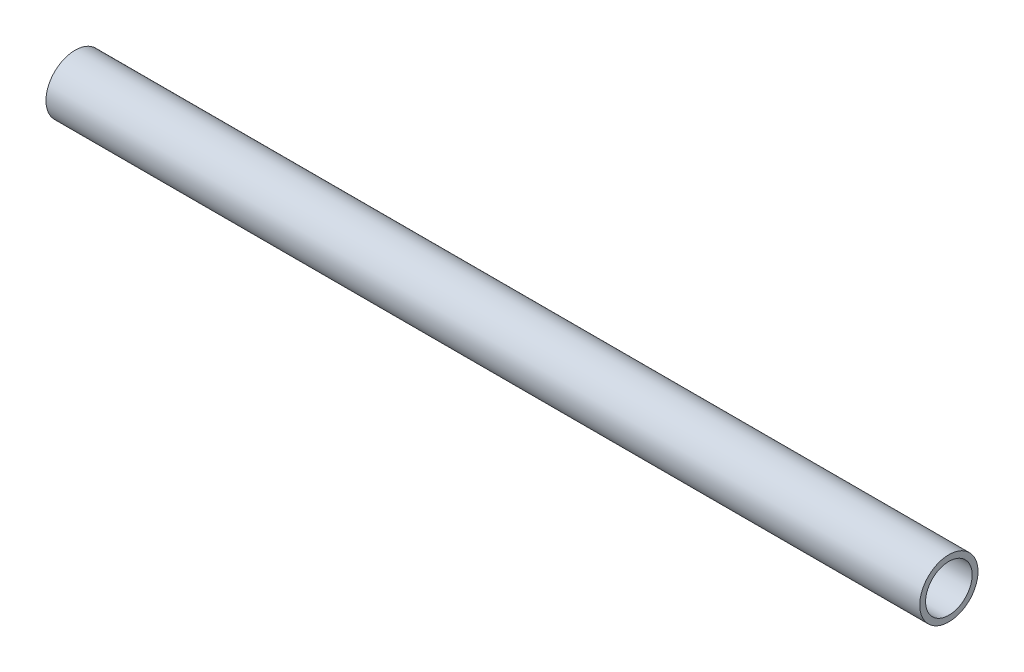
from build123d import *

# Parameters (mm, degrees)
SKETCH1_R           = 10
SKETCH1_R_2         = 8
BOSS_EXTRUDE1_DEPTH = 300


with BuildPart() as part:
    # Sketch1 → Boss-Extrude1 (new body)
    with BuildSketch(Plane(origin=(0, 0, 0), x_dir=(0, 0, -1), z_dir=(1, 0, 0))):
        Circle(SKETCH1_R)
        Circle(SKETCH1_R_2, mode=Mode.SUBTRACT)
    extrude(amount=BOSS_EXTRUDE1_DEPTH)


solid = part.part
